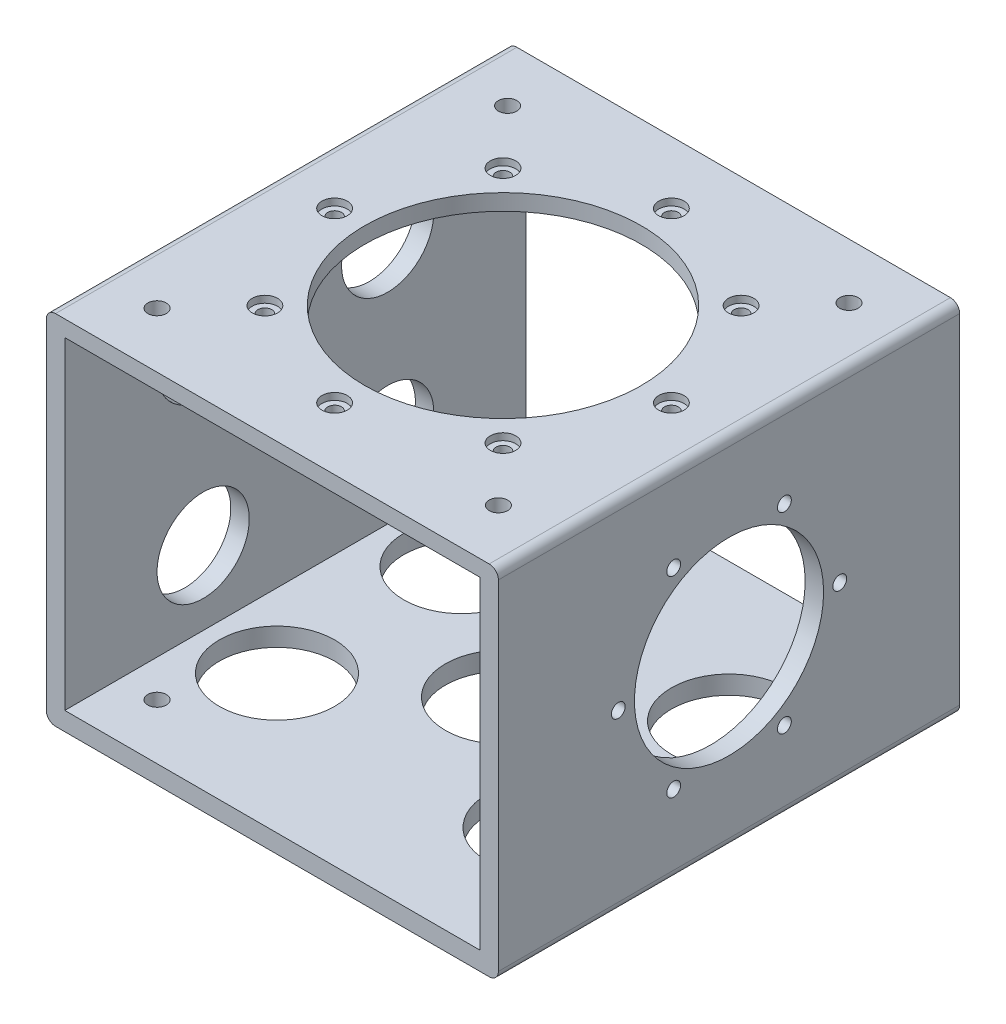
from build123d import *

# Parameters (mm, degrees)
SKETCH_1_W           = 90
SKETCH_1_H           = 80
SKETCH_1_R           = 30
EXTRUDE_1_DEPTH      = 4
SKETCH_2_R           = 1.5
CUT_EXTRUDE_1_DEPTH  = 4
SKETCH_3_W           = 80
SKETCH_3_H           = 80
EXTRUDE_2_DEPTH      = 4
SKETCH_4_W           = 80
SKETCH_4_H           = 80
EXTRUDE_3_DEPTH      = 4
SKETCH_5_R           = 1.5
CUT_EXTRUDE_2_DEPTH  = 4
SKETCH_6_R           = 20.5
CUT_EXTRUDE_3_DEPTH  = 4
SKETCH_8_W           = 98
SKETCH_8_H           = 80
EXTRUDE_4_DEPTH      = 4
SKETCH_9_R           = 8
CUT_EXTRUDE_5_DEPTH  = 4
SKETCH_10_R          = 2.75
CUT_EXTRUDE_6_DEPTH  = 2
SKETCH_11_W          = 106.087882822
SKETCH_11_H          = 86.695474134
CUT_EXTRUDE_7_DEPTH  = 2
SKETCH_12_W          = 90
SKETCH_12_H          = 80
EXTRUDE_5_DEPTH      = 2
SKETCH_13_W          = 115.80209227
SKETCH_13_H          = 95.07614962
CUT_EXTRUDE_8_DEPTH  = 0.5
SKETCH_14_R          = 12.5
CUT_EXTRUDE_9_DEPTH  = 4
FILLET_1_R           = 2
CUT_EXTRUDE_10_REACH = 131.151
SKETCH_15_R          = 10
SKETCH_16_W          = 90
SKETCH_16_H          = 70
EXTRUDE_6_DEPTH      = 10
SKETCH_17_W          = 90
SKETCH_17_H          = 70
EXTRUDE_7_DEPTH      = 10
SKETCH_19_R          = 2
CUT_EXTRUDE_12_DEPTH = 105.43778052
SKETCH_20_R          = 8
SKETCH_20_R_2        = 7.5
EXTRUDE_8_DEPTH      = 4


with BuildPart() as part:
    # 草图1 → 凸台-拉伸1 (new body)
    with BuildSketch(Plane(origin=(0, 0, 0), x_dir=(1, 0, 0), z_dir=(0, 1, 0))):
        Rectangle(SKETCH_1_W, SKETCH_1_H)
        with Locations(Location((0, 0, 0), (0, 0, 270))):
            Circle(SKETCH_1_R, mode=Mode.SUBTRACT)
    extrude(amount=EXTRUDE_1_DEPTH)

    # 草图2 → 切除-拉伸1 (cut)
    with BuildSketch(Plane(origin=(0, 4, 0), x_dir=(1, 0, 0), z_dir=(0, 1, 0))):
        with Locations(Location((0, 36.5, 0), (0, 0, 270))):
            Circle(SKETCH_2_R)
        with Locations(Location((25.809397513, 25.809397513, 0), (0, 0, 270))):
            Circle(SKETCH_2_R)
        with Locations(Location((36.5, 0, 0), (0, 0, 270))):
            Circle(SKETCH_2_R)
        with Locations(Location((25.809397513, -25.809397513, 0), (0, 0, 270))):
            Circle(SKETCH_2_R)
        with Locations(Location((0, -36.5, 0), (0, 0, 270))):
            Circle(SKETCH_2_R)
        with Locations(Location((-25.809397513, -25.809397513, 0), (0, 0, 270))):
            Circle(SKETCH_2_R)
        with Locations(Location((-36.5, 0, 0), (0, 0, 270))):
            Circle(SKETCH_2_R)
        with Locations(Location((-25.809397513, 25.809397513, 0), (0, 0, 270))):
            Circle(SKETCH_2_R)
    extrude(amount=-CUT_EXTRUDE_1_DEPTH, mode=Mode.SUBTRACT)

    # 草图3 → 凸台-拉伸2 (add)
    with BuildSketch(Plane(origin=(45, 0, 0), x_dir=(0, 0, -1), z_dir=(1, 0, 0))):
        with Locations((0, -36)):
            Rectangle(SKETCH_3_W, SKETCH_3_H)
    extrude(amount=EXTRUDE_2_DEPTH)

    # 草图4 → 凸台-拉伸3 (add)
    with BuildSketch(Plane.ZY.offset(45)):
        with Locations((0, -36)):
            Rectangle(SKETCH_4_W, SKETCH_4_H)
    extrude(amount=EXTRUDE_3_DEPTH)

    # 草图5 → 切除-拉伸2 (cut)
    with BuildSketch(Plane(origin=(49, 0, 0), x_dir=(0, 0, -1), z_dir=(1, 0, 0))):
        with Locations((-24, -36)):
            Circle(SKETCH_5_R)
        with Locations((-12, -15.215390309)):
            Circle(SKETCH_5_R)
        with Locations((12, -15.215390309)):
            Circle(SKETCH_5_R)
        with Locations((24, -36)):
            Circle(SKETCH_5_R)
        with Locations((12, -56.784609691)):
            Circle(SKETCH_5_R)
        with Locations((-12, -56.784609691)):
            Circle(SKETCH_5_R)
    extrude(amount=-CUT_EXTRUDE_2_DEPTH, mode=Mode.SUBTRACT)

    # 草图6 → 切除-拉伸3 (cut)
    with BuildSketch(Plane(origin=(49, 0, 0), x_dir=(0, 0, -1), z_dir=(1, 0, 0))):
        with Locations((0, -36)):
            Circle(SKETCH_6_R)
    extrude(amount=-CUT_EXTRUDE_3_DEPTH, mode=Mode.SUBTRACT)

    # 草图8 → 凸台-拉伸4 (add)
    with BuildSketch(Plane.XZ.offset(76)):
        Rectangle(SKETCH_8_W, SKETCH_8_H)
    extrude(amount=-EXTRUDE_4_DEPTH)

    # 草图9 → 切除-拉伸5 (cut)
    with BuildSketch(Plane.ZY.offset(49)):
        with Locations((0, -36)):
            Circle(SKETCH_9_R)
    extrude(amount=-CUT_EXTRUDE_5_DEPTH, mode=Mode.SUBTRACT)

    # 草图10 → 切除-拉伸6 (cut)
    with BuildSketch(Plane(origin=(0, 4, 0), x_dir=(1, 0, 0), z_dir=(0, 1, 0))):
        with Locations(Location((-25.809397513, 25.809397513, 0), (0, 0, 270))):
            Circle(SKETCH_10_R)
        with Locations(Location((0, 36.5, 0), (0, 0, 270))):
            Circle(SKETCH_10_R)
        with Locations(Location((25.809397513, 25.809397513, 0), (0, 0, 270))):
            Circle(SKETCH_10_R)
        with Locations(Location((36.5, 0, 0), (0, 0, 270))):
            Circle(SKETCH_10_R)
        with Locations(Location((25.809397513, -25.809397513, 0), (0, 0, 270))):
            Circle(SKETCH_10_R)
        with Locations(Location((0, -36.5, 0), (0, 0, 270))):
            Circle(SKETCH_10_R)
        with Locations(Location((-25.809397513, -25.809397513, 0), (0, 0, 270))):
            Circle(SKETCH_10_R)
        with Locations(Location((-36.5, 0, 0), (0, 0, 270))):
            Circle(SKETCH_10_R)
    extrude(amount=-CUT_EXTRUDE_6_DEPTH, mode=Mode.SUBTRACT)

    # 草图11 → 切除-拉伸7 (cut)
    with BuildSketch(Plane.XZ.offset(76)):
        with Locations((0.826302958, 0.912583938)):
            Rectangle(SKETCH_11_W, SKETCH_11_H)
    extrude(amount=-CUT_EXTRUDE_7_DEPTH, mode=Mode.SUBTRACT)

    # 草图12 → 凸台-拉伸5 (add)
    with BuildSketch(Plane(origin=(0, -72, 0), x_dir=(1, 0, 0), z_dir=(0, 1, 0))):
        Rectangle(SKETCH_12_W, SKETCH_12_H)
    extrude(amount=EXTRUDE_5_DEPTH)

    # 草图13 → 切除-拉伸8 (cut)
    with BuildSketch(Plane(origin=(0, 4, 0), x_dir=(1, 0, 0), z_dir=(0, 1, 0))):
        with Locations((-2.14666103, 3.125340558)):
            Rectangle(SKETCH_13_W, SKETCH_13_H)
    extrude(amount=-CUT_EXTRUDE_8_DEPTH, mode=Mode.SUBTRACT)

    # 草图14 → 切除-拉伸9 (cut)
    with BuildSketch(Plane.XZ.offset(74)):
        with Locations(Location((-29, 20, 0), (0, 0, 270))):
            Circle(SKETCH_14_R)
        with Locations(Location((29, 20, 0), (0, 0, 270))):
            Circle(SKETCH_14_R)
        with Locations(Location((0, 0, 0), (0, 0, 270))):
            Circle(SKETCH_14_R)
        with Locations(Location((-29, -20, 0), (0, 0, 270))):
            Circle(SKETCH_14_R)
        with Locations(Location((29, -20, 0), (0, 0, 270))):
            Circle(SKETCH_14_R)
    extrude(amount=-CUT_EXTRUDE_9_DEPTH, mode=Mode.SUBTRACT)

    # 圆角1
    fillet_1_edges = [part.edges().sort_by_distance(p)[0] for p in [
        (-49, -74, 0),
        (49, -74, 0),
        (49, 3.5, 0),
        (-49, 3.5, 0),
    ]]
    fillet(fillet_1_edges, radius=FILLET_1_R)

    # 草图15 → 切除-拉伸10 (cut, up to next)
    with BuildSketch(Plane.ZY.offset(49), mode=Mode.PRIVATE) as cut_extrude_10_sk1:
        with Locations((-20, -16.5)):
            Circle(SKETCH_15_R)
    cut_extrude_10_tool1 = extrude(cut_extrude_10_sk1.sketch, amount=-CUT_EXTRUDE_10_REACH, mode=Mode.PRIVATE) & part.part
    # 草图15 → 切除-拉伸10 (cut, up to next)
    with BuildSketch(Plane.ZY.offset(49), mode=Mode.PRIVATE) as cut_extrude_10_sk2:
        with Locations((20, -16.5)):
            Circle(SKETCH_15_R)
    cut_extrude_10_tool2 = extrude(cut_extrude_10_sk2.sketch, amount=-CUT_EXTRUDE_10_REACH, mode=Mode.PRIVATE) & part.part
    # 草图15 → 切除-拉伸10 (cut, up to next)
    with BuildSketch(Plane.ZY.offset(49), mode=Mode.PRIVATE) as cut_extrude_10_sk3:
        with Locations((20, -54)):
            Circle(SKETCH_15_R)
    cut_extrude_10_tool3 = extrude(cut_extrude_10_sk3.sketch, amount=-CUT_EXTRUDE_10_REACH, mode=Mode.PRIVATE) & part.part
    # 草图15 → 切除-拉伸10 (cut, up to next)
    with BuildSketch(Plane.ZY.offset(49), mode=Mode.PRIVATE) as cut_extrude_10_sk4:
        with Locations((-20, -54)):
            Circle(SKETCH_15_R)
    cut_extrude_10_tool4 = extrude(cut_extrude_10_sk4.sketch, amount=-CUT_EXTRUDE_10_REACH, mode=Mode.PRIVATE) & part.part
    add(cut_extrude_10_tool1.solids().sort_by_distance((-49, -16.5, -20))[0], mode=Mode.SUBTRACT)
    add(cut_extrude_10_tool2.solids().sort_by_distance((-49, -16.5, 20))[0], mode=Mode.SUBTRACT)
    add(cut_extrude_10_tool3.solids().sort_by_distance((-49, -54, 20))[0], mode=Mode.SUBTRACT)
    add(cut_extrude_10_tool4.solids().sort_by_distance((-49, -54, -20))[0], mode=Mode.SUBTRACT)

    # 草图16 → 凸台-拉伸6 (add)
    with BuildSketch(Plane(origin=(0, 0, -40), x_dir=(-1, 0, 0), z_dir=(0, 0, -1))):
        with BuildLine():
            Line((-47, -74), (47, -74))
            ThreePointArc((47, -74), (48.414213562, -73.414213562), (49, -72))
            Line((49, -72), (49, 1.5))
            ThreePointArc((49, 1.5), (48.414213562, 2.914213562), (47, 3.5))
            Line((47, 3.5), (-47, 3.5))
            ThreePointArc((-47, 3.5), (-48.414213562, 2.914213562), (-49, 1.5))
            Line((-49, 1.5), (-49, -72))
            ThreePointArc((-49, -72), (-48.414213562, -73.414213562), (-47, -74))
        make_face()
        with Locations((0, -35)):
            Rectangle(SKETCH_16_W, SKETCH_16_H, mode=Mode.SUBTRACT)
    extrude(amount=EXTRUDE_6_DEPTH)

    # 草图17 → 凸台-拉伸7 (add)
    with BuildSketch(Plane.XY.offset(40)):
        with BuildLine():
            Line((-49, 1.5), (-49, -72))
            ThreePointArc((-49, -72), (-48.414213562, -73.414213562), (-47, -74))
            Line((-47, -74), (47, -74))
            ThreePointArc((47, -74), (48.414213562, -73.414213562), (49, -72))
            Line((49, -72), (49, 1.5))
            ThreePointArc((49, 1.5), (48.414213562, 2.914213562), (47, 3.5))
            Line((47, 3.5), (-47, 3.5))
            ThreePointArc((-47, 3.5), (-48.414213562, 2.914213562), (-49, 1.5))
        make_face()
        with Locations((0, -35)):
            Rectangle(SKETCH_17_W, SKETCH_17_H, mode=Mode.SUBTRACT)
    extrude(amount=EXTRUDE_7_DEPTH)

    # 草图19 → 切除-拉伸12 (cut, through all)
    with BuildSketch(Plane.XZ.offset(74)):
        with Locations(Location((37, -38, 0), (0, 0, 90))):
            Circle(SKETCH_19_R)
        with Locations(Location((-37, 38, 0), (0, 0, 270))):
            Circle(SKETCH_19_R)
        with Locations(Location((37, 38, 0), (0, 0, 270))):
            Circle(SKETCH_19_R)
        with Locations(Location((-37, -38, 0), (0, 0, 90))):
            Circle(SKETCH_19_R)
    extrude(amount=-CUT_EXTRUDE_12_DEPTH, mode=Mode.SUBTRACT)

    # 草图20 → 凸台-拉伸8 (add)
    with BuildSketch(Plane.ZY.offset(49)):
        with Locations((0, -36)):
            Circle(SKETCH_20_R)
        with Locations((0, -36)):
            Circle(SKETCH_20_R_2, mode=Mode.SUBTRACT)
    extrude(amount=-EXTRUDE_8_DEPTH)


solid = part.part
